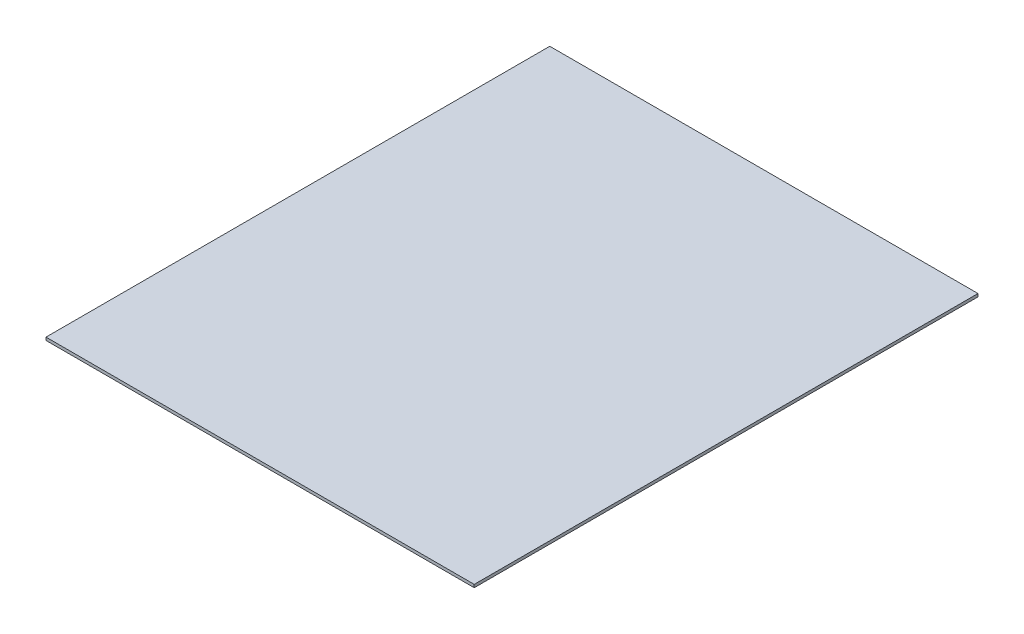
from build123d import *

# Parameters (mm, degrees)
SKETCH1_W           = 292
SKETCH1_H           = 372
BOSS_EXTRUDE1_DEPTH = 2
SKETCH2_W           = 292
SKETCH2_H           = 28.5
CUT_EXTRUDE1_DEPTH  = 2


with BuildPart() as part:
    # Sketch1 → Boss-Extrude1 (new body)
    with BuildSketch(Plane(origin=(0, 0, 0), x_dir=(1, 0, 0), z_dir=(0, 1, 0))):
        with Locations((34.400934579, -52.402180685)):
            Rectangle(SKETCH1_W, SKETCH1_H)
    extrude(amount=BOSS_EXTRUDE1_DEPTH)

    # Sketch2 → Cut-Extrude1 (cut)
    with BuildSketch(Plane(origin=(0, 2, 0), x_dir=(1, 0, 0), z_dir=(0, 1, 0))):
        with Locations((34.400934579, -224.152180685)):
            Rectangle(SKETCH2_W, SKETCH2_H)
    extrude(amount=-CUT_EXTRUDE1_DEPTH, mode=Mode.SUBTRACT)


solid = part.part
